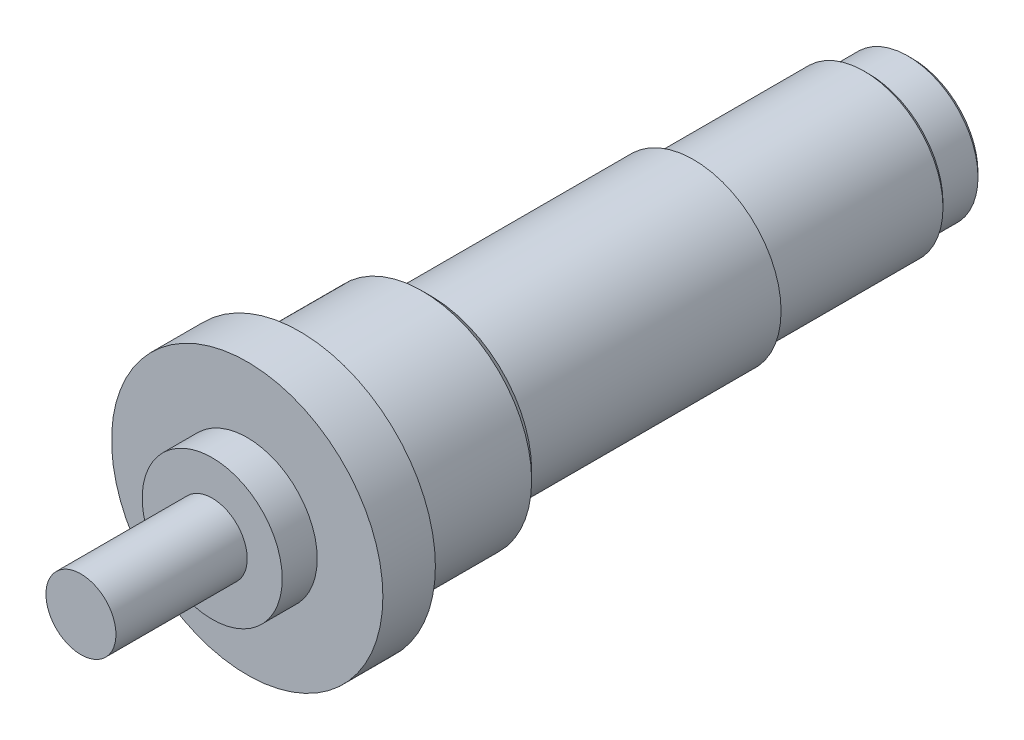
from build123d import *

# Parameters (mm, degrees)
CHAMFER_1_SIZE = 1
CHAMFER_2_SIZE = 0.5


with BuildPart() as part:
    # 草图1 → 旋转1 (revolve)
    with BuildSketch(Plane(origin=(0, 0, 0), x_dir=(0, 0, -1), z_dir=(1, 0, 0)), mode=Mode.PRIVATE) as revolve_1_sk:
        Polygon((-47.5, 0), (-47.5, 4), (-32.5, 4), (-32.5, 8), (-28.5, 8), (-28.5, 15.5), (-22.5, 15.5), (-22.5, 12.5), (-7.5, 12.5), (-7.5, 10), (22.5, 10), (22.5, 9), (42.5, 9), (42.5, 8), (47.5, 8), (47.5, 0), align=None)
    revolve(revolve_1_sk.sketch.rotate(Axis((0, 0, 113.714285714), (0, 0, -1)), 90), axis=Axis((0, 0, 113.714285714), (0, 0, -1)))

    # 倒角1
    chamfer_1_edges = [part.edges().sort_by_distance(p)[0] for p in [
        (-12.5, 0, 7.5),
    ]]
    chamfer(chamfer_1_edges, length=CHAMFER_1_SIZE)

    # 倒角2
    chamfer_2_edges = [part.edges().sort_by_distance(p)[0] for p in [
        (-8, 0, -47.5),
        (-9, 0, -42.5),
    ]]
    chamfer(chamfer_2_edges, length=CHAMFER_2_SIZE)


solid = part.part
